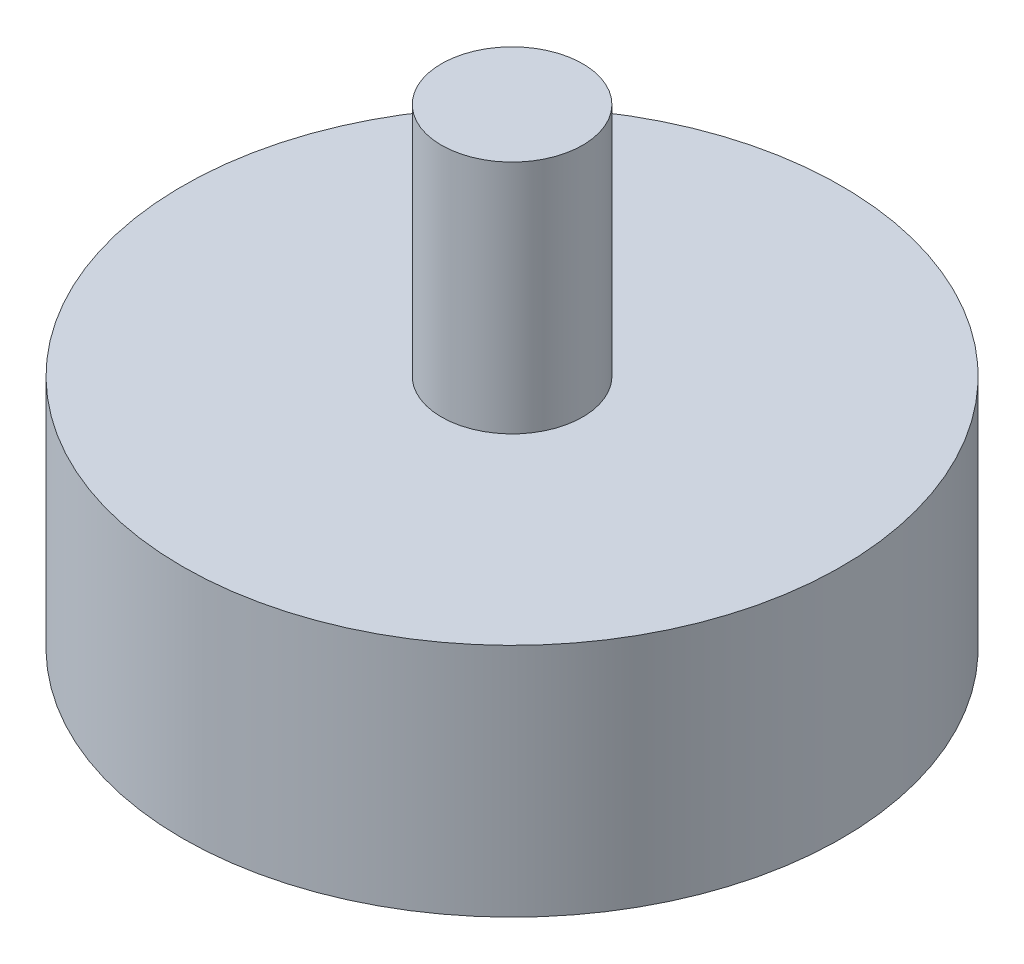
from build123d import *

# Parameters (mm, degrees)
SKETCH1_R           = 70
BOSS_EXTRUDE1_DEPTH = 50
SKETCH2_R           = 15
BOSS_EXTRUDE2_DEPTH = 50
CUT_EXTRUDE1_DEPTH  = 5


with BuildPart() as part:
    # Sketch1 → Boss-Extrude1 (new body)
    with BuildSketch(Plane(origin=(0, 0, 0), x_dir=(1, 0, 0), z_dir=(0, 1, 0))):
        with Locations(Location((0, 0, 0), (0, 0, 270))):
            Circle(SKETCH1_R)
    extrude(amount=BOSS_EXTRUDE1_DEPTH)

    # Sketch2 → Boss-Extrude2 (add)
    with BuildSketch(Plane(origin=(0, 50, 0), x_dir=(1, 0, 0), z_dir=(0, 1, 0))):
        with Locations(Location((0, 0, 0), (0, 0, 270))):
            Circle(SKETCH2_R)
    extrude(amount=BOSS_EXTRUDE2_DEPTH)

    # Sketch3 → Cut-Extrude1 (cut)
    with BuildSketch(Plane.XZ):
        Polygon((-16.192060877, 11.114878754), (27.540819943, 58.8770179), (10.111567195, 18.864926724), (21.881207876, 18.864926724), (0, -11.114878754), (16.192060877, -11.114878754), (-27.540819943, -58.8770179), (-8.388481815, -16.504098893), (-20.158122496, -16.504098893), (0, 11.114878754), align=None)
    extrude(amount=-CUT_EXTRUDE1_DEPTH, mode=Mode.SUBTRACT)


solid = part.part
